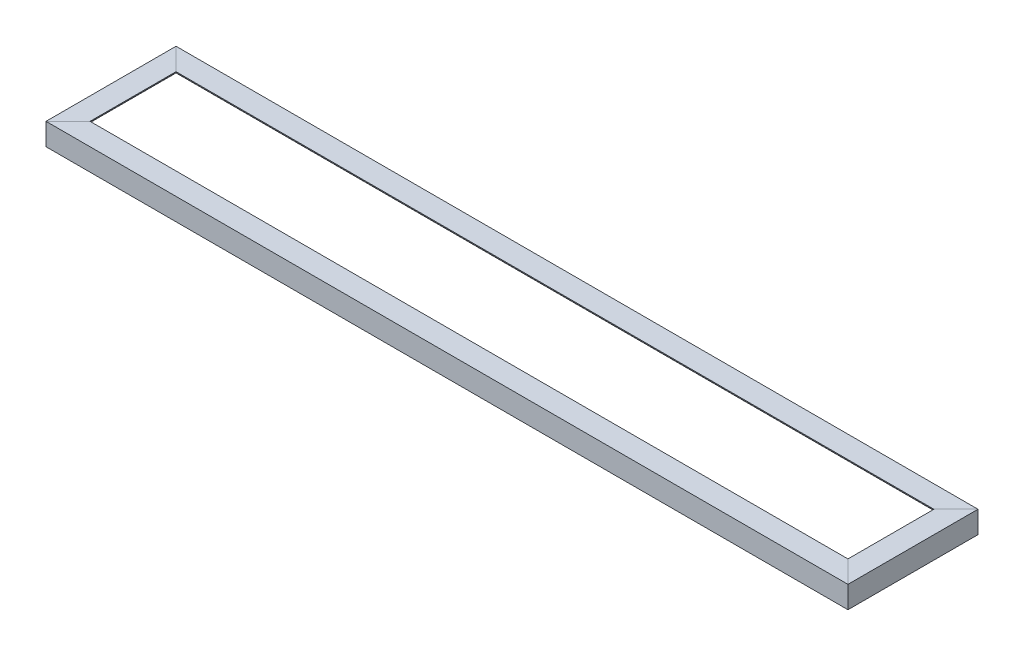
from build123d import *

# Parameters (mm, degrees)
HIERRO_ANGULAR_1_X_1_X_0_125_1_DEPTH      = 961.921024484
HIERRO_ANGULAR_1_X_1_X_0_125_1_DEPTH_BACK = 36.921024484
HIERRO_ANGULAR_1_X_1_X_0_125_1_2_DEPTH    = 223.842048969
HIERRO_ANGULAR_1_X_1_X_0_125_1_3_DEPTH    = 998.842048969
HIERRO_ANGULAR_1_X_1_X_0_125_1_4_DEPTH    = 223.842048969


with BuildPart() as part:
    # Sketch11 → Hierro angular 1 X 1 X 0.125(1) (new, two sides: drawn at the far end of the back side and taken through both)
    with BuildSketch(Plane(origin=(462.5, 0, 75), x_dir=(0, 0, -1), z_dir=(-1, 0, 0)).offset(-HIERRO_ANGULAR_1_X_1_X_0_125_1_DEPTH_BACK)):
        with BuildLine():
            Line((0, 0), (0, 25.4))
            Line((0, 25.4), (0.00508, 25.4))
            ThreePointArc((0.00508, 25.4), (2.246551928, 24.471551928), (3.175, 22.23008))
            Line((3.175, 22.23008), (3.175, 7.9375))
            ThreePointArc((3.175, 7.9375), (4.569903955, 4.569903955), (7.9375, 3.175))
            Line((7.9375, 3.175), (22.23008, 3.175))
            ThreePointArc((22.23008, 3.175), (24.471551928, 2.246551928), (25.4, 0.00508))
            Line((25.4, 0.00508), (25.4, 0))
            Line((25.4, 0), (0, 0))
        make_face()
    extrude(amount=HIERRO_ANGULAR_1_X_1_X_0_125_1_DEPTH + HIERRO_ANGULAR_1_X_1_X_0_125_1_DEPTH_BACK)

    # Hierro angular 1 X 1 X 0.125(1) mitre 1
    split(bisect_by=Plane(origin=(462.5, 0, 75), x_dir=(0, -1, 0), z_dir=(-0.707106781, 0, 0.707106781)), keep=Keep.TOP)

    # Hierro angular 1 X 1 X 0.125(1) mitre 2
    split(bisect_by=Plane(origin=(-462.5, 0, 75), x_dir=(0, 1, 0), z_dir=(0.707106781, 0, 0.707106781)), keep=Keep.TOP)


with BuildPart() as body_2:
    # Sketch11 on segment 2 (carried to segment 2) → Hierro angular 1 X 1 X 0.125_1 2 (new body)
    with BuildSketch(Plane(origin=(-462.5, 0, 111.921024484), x_dir=(1, 0, 0), z_dir=(0, 0, -1))):
        with BuildLine():
            Line((0, 0), (0, 25.4))
            Line((0, 25.4), (0.00508, 25.4))
            ThreePointArc((0.00508, 25.4), (2.246551928, 24.471551928), (3.175, 22.23008))
            Line((3.175, 22.23008), (3.175, 7.9375))
            ThreePointArc((3.175, 7.9375), (4.569903955, 4.569903955), (7.9375, 3.175))
            Line((7.9375, 3.175), (22.23008, 3.175))
            ThreePointArc((22.23008, 3.175), (24.471551928, 2.246551928), (25.4, 0.00508))
            Line((25.4, 0.00508), (25.4, 0))
            Line((25.4, 0), (0, 0))
        make_face()
    extrude(amount=HIERRO_ANGULAR_1_X_1_X_0_125_1_2_DEPTH)

    # Hierro angular 1 X 1 X 0.125_1 2 mitre 1
    split(bisect_by=Plane(origin=(-462.5, 0, 75), x_dir=(0, -1, 0), z_dir=(-0.707106781, 0, -0.707106781)), keep=Keep.TOP)

    # Hierro angular 1 X 1 X 0.125_1 2 mitre 2
    split(bisect_by=Plane(origin=(-462.5, 0, -75), x_dir=(0, -1, 0), z_dir=(-0.707106781, 0, 0.707106781)), keep=Keep.TOP)


with BuildPart() as body_3:
    # Sketch11 on segment 3 (carried to segment 3) → Hierro angular 1 X 1 X 0.125_1 3 (new body)
    with BuildSketch(Plane(origin=(-499.421024484, 0, -75), x_dir=(0, 0, 1), z_dir=(1, 0, 0))):
        with BuildLine():
            Line((0, 0), (0, 25.4))
            Line((0, 25.4), (0.00508, 25.4))
            ThreePointArc((0.00508, 25.4), (2.246551928, 24.471551928), (3.175, 22.23008))
            Line((3.175, 22.23008), (3.175, 7.9375))
            ThreePointArc((3.175, 7.9375), (4.569903955, 4.569903955), (7.9375, 3.175))
            Line((7.9375, 3.175), (22.23008, 3.175))
            ThreePointArc((22.23008, 3.175), (24.471551928, 2.246551928), (25.4, 0.00508))
            Line((25.4, 0.00508), (25.4, 0))
            Line((25.4, 0), (0, 0))
        make_face()
    extrude(amount=HIERRO_ANGULAR_1_X_1_X_0_125_1_3_DEPTH)

    # Hierro angular 1 X 1 X 0.125_1 3 mitre 1
    split(bisect_by=Plane(origin=(462.5, 0, -75), x_dir=(0, -1, 0), z_dir=(-0.707106781, 0, -0.707106781)), keep=Keep.TOP)

    # Hierro angular 1 X 1 X 0.125_1 3 mitre 2
    split(bisect_by=Plane(origin=(-462.5, 0, -75), x_dir=(0, 1, 0), z_dir=(0.707106781, 0, -0.707106781)), keep=Keep.TOP)


with BuildPart() as body_4:
    # Sketch11 on segment 4 (carried to segment 4) → Hierro angular 1 X 1 X 0.125_1 4 (new body)
    with BuildSketch(Plane(origin=(462.5, 0, -111.921024484), x_dir=(-1, 0, 0), z_dir=(0, 0, 1))):
        with BuildLine():
            Line((0, 0), (0, 25.4))
            Line((0, 25.4), (0.00508, 25.4))
            ThreePointArc((0.00508, 25.4), (2.246551928, 24.471551928), (3.175, 22.23008))
            Line((3.175, 22.23008), (3.175, 7.9375))
            ThreePointArc((3.175, 7.9375), (4.569903955, 4.569903955), (7.9375, 3.175))
            Line((7.9375, 3.175), (22.23008, 3.175))
            ThreePointArc((22.23008, 3.175), (24.471551928, 2.246551928), (25.4, 0.00508))
            Line((25.4, 0.00508), (25.4, 0))
            Line((25.4, 0), (0, 0))
        make_face()
    extrude(amount=HIERRO_ANGULAR_1_X_1_X_0_125_1_4_DEPTH)

    # Hierro angular 1 X 1 X 0.125_1 4 mitre 1
    split(bisect_by=Plane(origin=(462.5, 0, 75), x_dir=(0, 1, 0), z_dir=(0.707106781, 0, -0.707106781)), keep=Keep.TOP)

    # Hierro angular 1 X 1 X 0.125_1 4 mitre 2
    split(bisect_by=Plane(origin=(462.5, 0, -75), x_dir=(0, 1, 0), z_dir=(0.707106781, 0, 0.707106781)), keep=Keep.TOP)


solid = Compound([part.part, body_2.part, body_3.part, body_4.part])
